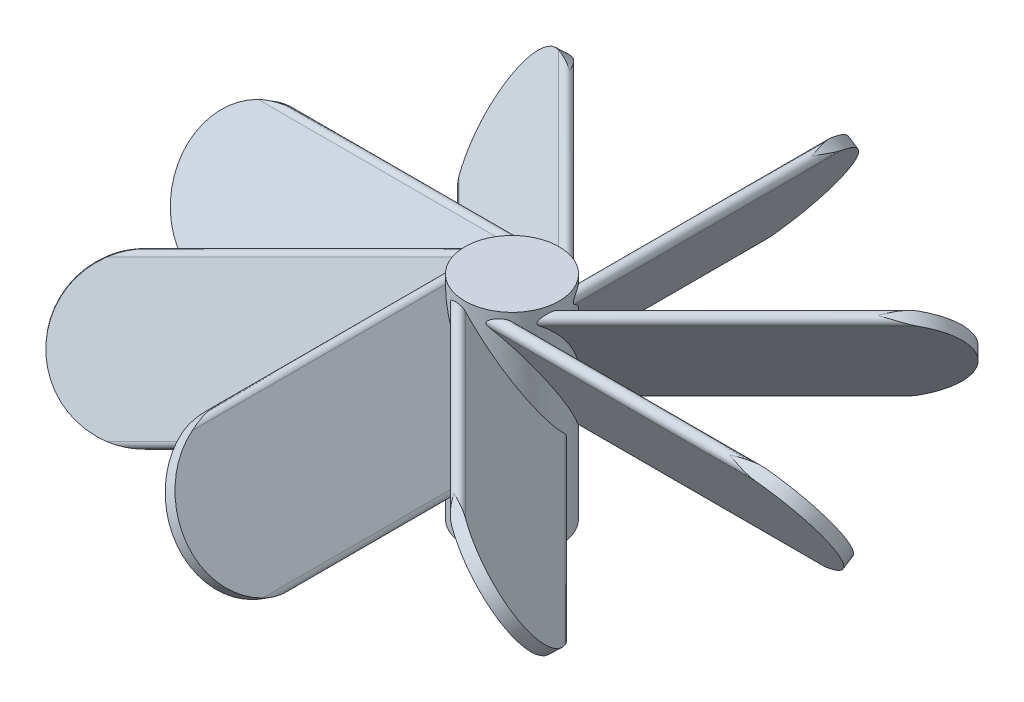
from build123d import *

# Parameters (mm, degrees)
SKETCH1_R           = 20
BOSS_EXTRUDE1_DEPTH = 90
BOSS_EXTRUDE2_DEPTH = 140
CUT_EXTRUDE1_DEPTH  = 10
CIRPATTERN1_COUNT   = 8


with BuildPart() as part:
    # Sketch1 → Boss-Extrude1 (new body)
    with BuildSketch(Plane(origin=(0, 90, 0), x_dir=(1, 0, 0), z_dir=(0, 1, 0))):
        with Locations(Location((0, -500, 0), (0, 0, 90))):
            Circle(SKETCH1_R)
    extrude(amount=BOSS_EXTRUDE1_DEPTH)

    # Sketch2 → Boss-Extrude2 (add)
    with BuildSketch(Plane(origin=(0, 0, 500), x_dir=(-1, 0, 0), z_dir=(0, 0, -1))):
        with BuildLine():
            Line((-13.985608161, 176.282979568), (15.970465809, 129.684642281))
            ThreePointArc((15.970465809, 129.684642281), (15.227653925, 126.267707614), (11.810719258, 127.010519498))
            Line((11.810719258, 127.010519498), (-18.145354712, 173.608856785))
            ThreePointArc((-18.145354712, 173.608856785), (-17.402542828, 177.025791452), (-13.985608161, 176.282979568))
        make_face()
    boss_extrude2 = extrude(amount=BOSS_EXTRUDE2_DEPTH)

    # Sketch3 → Cut-Extrude1 (cut)
    with BuildSketch(Plane(origin=(-70.290527892, 45.18676793, 0), x_dir=(0, 0, 1), z_dir=(-0.8411784753765537, 0.5407575913134988, 0))):
        with BuildLine():
            Line((390.170817088, 158.320842499), (379.515229855, 182.534349978))
            Line((379.515229855, 182.534349978), (295.548253273, 135.851217475))
            Line((295.548253273, 135.851217475), (337.531741564, 72.875985038))
            Line((337.531741564, 72.875985038), (390.170817088, 97.979208322))
            ThreePointArc((390.170817088, 97.979208322), (360, 128.15002541), (390.170817088, 158.320842499))
        make_face()
    cut_extrude1 = extrude(amount=-CUT_EXTRUDE1_DEPTH, mode=Mode.SUBTRACT)

    # CirPattern1: Boss-Extrude2, Cut-Extrude1 ×8 about axis
    cirpattern1_axis = Axis((0, 0, 500), (0, 1, 0))
    add([boss_extrude2.rotate(cirpattern1_axis, i * 360 / CIRPATTERN1_COUNT) for i in range(1, CIRPATTERN1_COUNT)])
    add([cut_extrude1.rotate(cirpattern1_axis, i * 360 / CIRPATTERN1_COUNT) for i in range(1, CIRPATTERN1_COUNT)], mode=Mode.SUBTRACT)


solid = part.part
